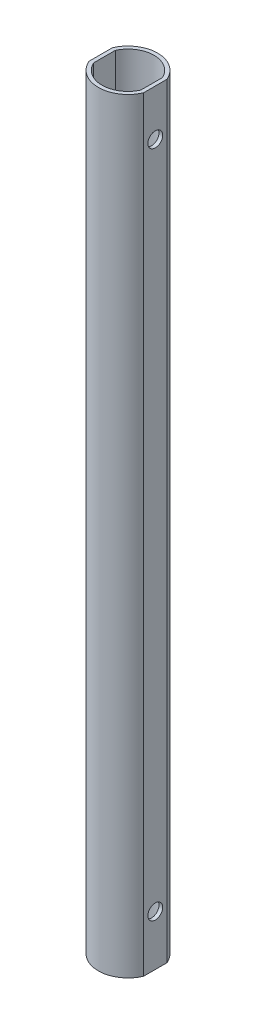
from build123d import *

# Parameters (mm, degrees)
BOSS_EXTRUDE1_DEPTH = 327.29
CUT_EXTRUDE1_REACH  = 330.367
SKETCH2_R           = 3.175


with BuildPart() as part:
    # Sketch1 → Boss-Extrude1 (new body)
    with BuildSketch(Plane(origin=(0, 0, 0), x_dir=(1, 0, 0), z_dir=(0, 1, 0))):
        with BuildLine():
            Line((11.674330816, -5), (11.674330816, 5))
            ThreePointArc((11.674330816, 5), (0, 12.7), (-11.674330816, 5))
            Line((-11.674330816, 5), (-11.674330816, -5))
            ThreePointArc((-11.674330816, -5), (0, -12.7), (11.674330816, -5))
        make_face()
        with BuildLine():
            Line((10.086830816, 4.662992638), (10.086830816, -4.662992638))
            ThreePointArc((10.086830816, -4.662992638), (0, -11.1125), (-10.086830816, -4.662992638))
            Line((-10.086830816, -4.662992638), (-10.086830816, 4.662992638))
            ThreePointArc((-10.086830816, 4.662992638), (0, 11.1125), (10.086830816, 4.662992638))
        make_face(mode=Mode.SUBTRACT)
    extrude(amount=BOSS_EXTRUDE1_DEPTH)

    # Cut-Extrude1: up to this face of the body (flat: up to its plane)
    cut_extrude1_end = Plane(part.part.faces().sort_by_distance((-11.674330816, 163.645, 0))[0])
    # Sketch2 → Cut-Extrude1 (cut, up to the picked face)
    with BuildSketch(Plane(origin=(11.674330816, 0, 0), x_dir=(0, 0, -1), z_dir=(1, 0, 0)), mode=Mode.PRIVATE) as cut_extrude1_sk1:
        with Locations((0, 21.5)):
            Circle(SKETCH2_R)
    cut_extrude1_tool1 = split(extrude(cut_extrude1_sk1.sketch, amount=-CUT_EXTRUDE1_REACH, mode=Mode.PRIVATE), bisect_by=cut_extrude1_end, keep=Keep.BOTH, mode=Mode.PRIVATE)
    # Sketch2 → Cut-Extrude1 (cut, up to the picked face)
    with BuildSketch(Plane(origin=(11.674330816, 0, 0), x_dir=(0, 0, -1), z_dir=(1, 0, 0)), mode=Mode.PRIVATE) as cut_extrude1_sk2:
        with Locations((0, 307.54)):
            Circle(SKETCH2_R)
    cut_extrude1_tool2 = split(extrude(cut_extrude1_sk2.sketch, amount=-CUT_EXTRUDE1_REACH, mode=Mode.PRIVATE), bisect_by=cut_extrude1_end, keep=Keep.BOTH, mode=Mode.PRIVATE)
    add(cut_extrude1_tool1.solids().sort_by(Axis((11.674331, 21.5, 0), (-1, 0, 0)))[0], mode=Mode.SUBTRACT)
    add(cut_extrude1_tool2.solids().sort_by(Axis((11.674331, 307.54, 0), (-1, 0, 0)))[0], mode=Mode.SUBTRACT)


solid = part.part
